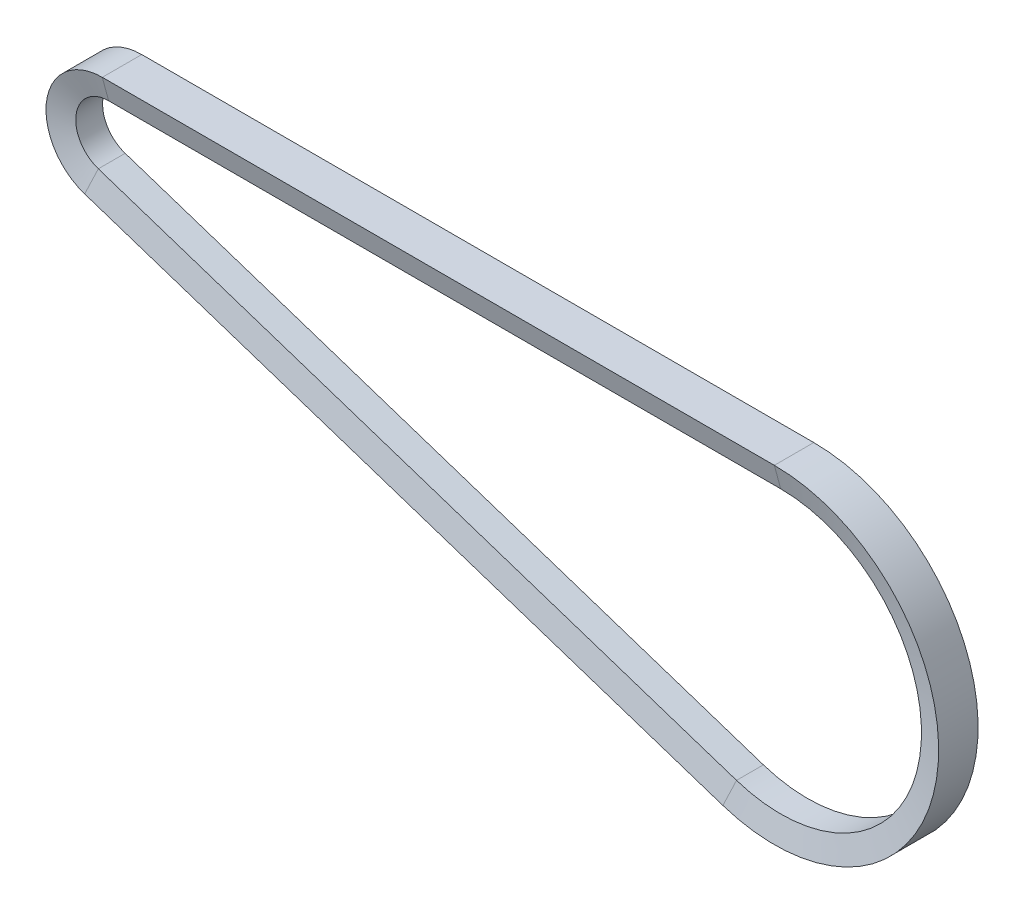
from build123d import *

# Parameters (mm, degrees)
RESSALTO_EXTRUS_O1_DEPTH = 5


with BuildPart() as part:
    # Varredura1: sweep along a path in Esboço1
    with BuildLine(Plane.XY) as varredura1_path:
        Line((0, 0), (-140.664241345, 0))
        ThreePointArc((-140.664241345, 0), (-154.486995682, -11.779310345), (-145.049390997, -27.295505351))
        Line((-145.049390997, -27.295505351), (126.870742838, -116.980737218))
        ThreePointArc((126.870742838, -116.980737218), (204.904617075, -69.517241379), (145.664241345, 0))
        Line((145.664241345, 0), (5, 0))
    # Esboço2 → Varredura1 (sweep)
    with BuildSketch(Plane(origin=(0, 0, 0), x_dir=(0, 0, -1), z_dir=(1, 0, 0))):
        Polygon((-8.4, 10), (8.4, 10), (5.720508076, 0), (-5.720508076, 0), align=None)
    sweep(path=varredura1_path.line)

    # Esboço3 → Ressalto-extrusão1 (add)
    with BuildSketch(Plane(origin=(0, 0, 0), x_dir=(0, 0, -1), z_dir=(1, 0, 0))):
        Polygon((-8.4, 10), (-5.720508076, 0), (5.720508076, 0), (8.4, 10), align=None)
    extrude(amount=RESSALTO_EXTRUS_O1_DEPTH)


solid = part.part
